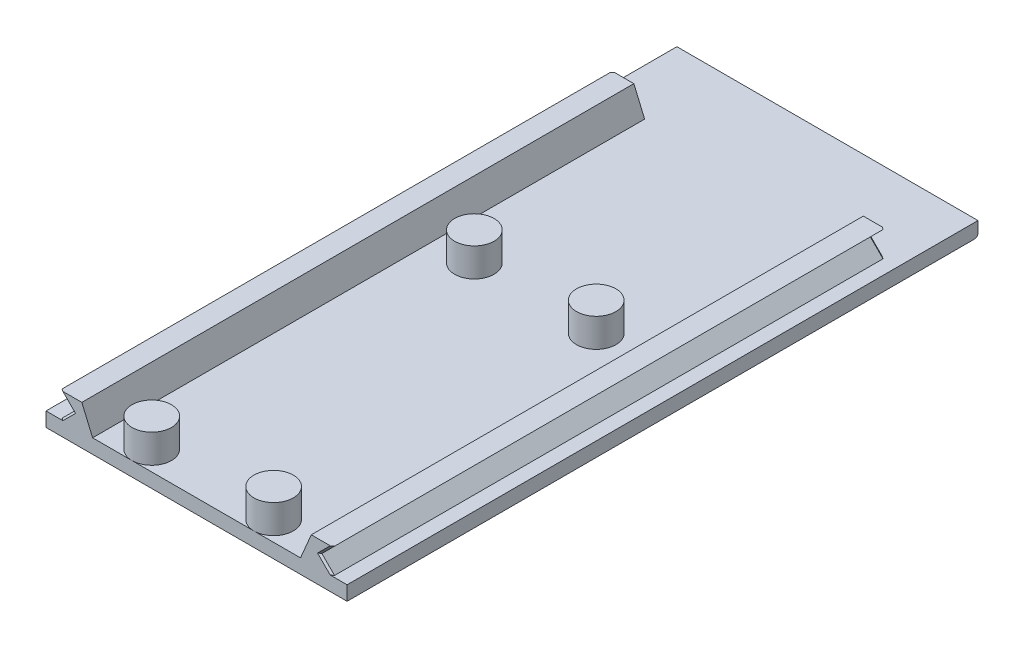
from build123d import *

# Parameters (mm, degrees)
SKETCH1_W           = 42
SKETCH1_H           = 88
BOSS_EXTRUDE1_DEPTH = 2
BOSS_EXTRUDE2_DEPTH = 77
SKETCH3_R           = 2.75
BOSS_EXTRUDE3_DEPTH = 4
FILLET1_R           = 0.5
CHAMFER3_SIZE       = 0.25


with BuildPart() as part:
    # Sketch1 → Boss-Extrude1 (new body)
    with BuildSketch(Plane(origin=(0, 0, 0), x_dir=(1, 0, 0), z_dir=(0, 1, 0))):
        Rectangle(SKETCH1_W, SKETCH1_H)
    extrude(amount=BOSS_EXTRUDE1_DEPTH)

    # Sketch2 → Boss-Extrude2 (add)
    with BuildSketch(Plane.XY.offset(44)):
        Polygon((14.5, 2), (16, 5.535533906), (19, 5.535533906), (17.232233047, 3.767766953), (19, 2), align=None)
    boss_extrude2 = extrude(amount=-BOSS_EXTRUDE2_DEPTH)

    # Mirror1: Boss-Extrude2 across plane
    add(boss_extrude2.mirror(Plane(origin=(0, 0, 0), x_dir=(0, 0, 1), z_dir=(1, 0, 0))))

    # Sketch3 → Boss-Extrude3 (add)
    with BuildSketch(Plane(origin=(0, 2, 0), x_dir=(1, 0, 0), z_dir=(0, 1, 0))):
        with Locations(Location((-9, -41.25, 0), (0, 0, 270))):
            Circle(SKETCH3_R)
        with Locations(Location((8, -41.25, 0), (0, 0, 270))):
            Circle(SKETCH3_R)
        with Locations(Location((8, 3.75, 0), (0, 0, 270))):
            Circle(SKETCH3_R)
        with Locations(Location((-9, 3.75, 0), (0, 0, 270))):
            Circle(SKETCH3_R)
    extrude(amount=BOSS_EXTRUDE3_DEPTH)

    # Fillet1
    fillet1_edges = [part.edges().sort_by_distance(p)[0] for p in [
        (0, 0, -44),
    ]]
    fillet(fillet1_edges, radius=FILLET1_R)

    # Chamfer3
    chamfer3_edges = [part.edges().sort_by_distance(p)[0] for p in [
        (18.116116524, 4.651650429, -33),
        (18.116116524, 2.883883476, -33),
        (18.116116524, 2.883883476, 44),
        (18.116116524, 4.651650429, 44),
        (-18.116116524, 2.883883476, 44),
        (-18.116116524, 4.651650429, 44),
        (-18.116116524, 2.883883476, -33),
        (-18.116116524, 4.651650429, -33),
    ]]
    chamfer(chamfer3_edges, length=CHAMFER3_SIZE)


solid = part.part
